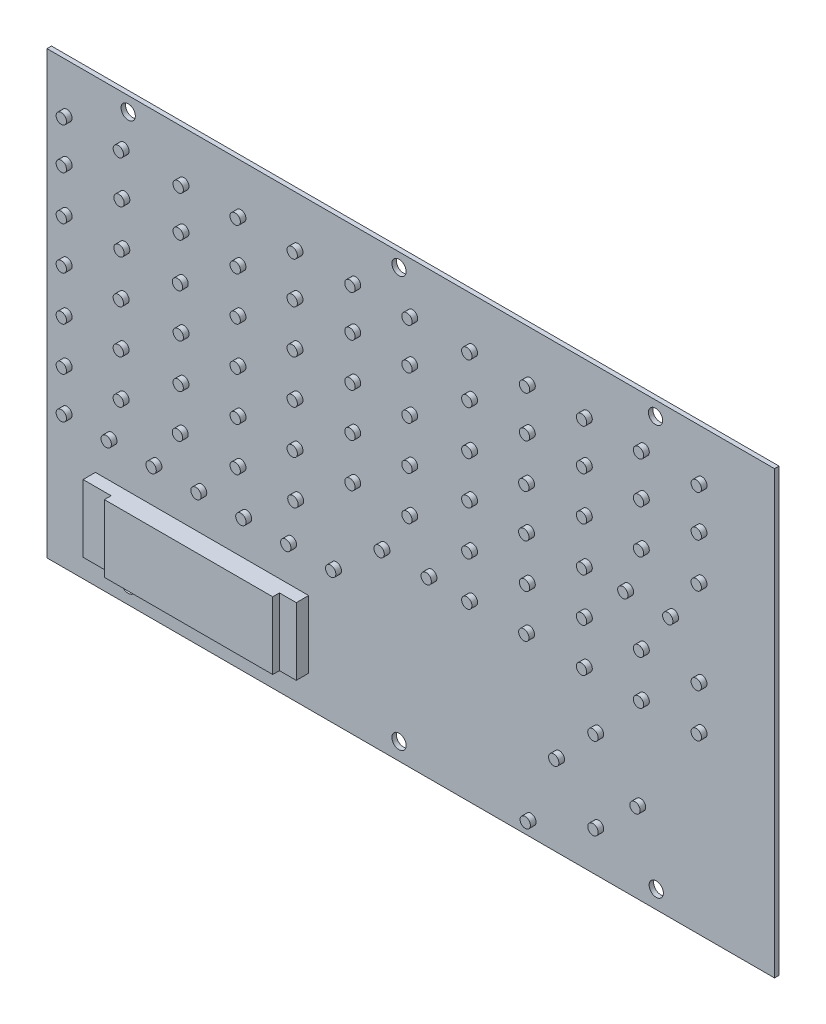
from build123d import *

# Parameters (mm, degrees)
SKETCH_2_W          = 129.667
SKETCH_2_H          = 78.613
EXTRUDE_1_DEPTH     = 0.8
SKETCH_3_R          = 1.27
CUT_EXTRUDE_1_DEPTH = 12.54
SKETCH_4_R          = 0.92202
SKETCH_4_R_2        = 0.922029104
SKETCH_4_R_3        = 0.919681264
SKETCH_4_R_4        = 0.924963229
SKETCH_4_R_5        = 0.92552898
EXTRUDE_2_DEPTH     = 1
SKETCH_5_W          = 38
SKETCH_5_H          = 12
EXTRUDE_3_DEPTH     = 2.2
SKETCH_6_W          = 30
SKETCH_6_H          = 12
EXTRUDE_4_DEPTH     = 1.2


with BuildPart() as part:
    # 草图2 → 凸台-拉伸1 (new body)
    with BuildSketch(Plane.XY):
        with Locations((83.3755, 41.2115)):
            Rectangle(SKETCH_2_W, SKETCH_2_H)
    extrude(amount=EXTRUDE_1_DEPTH)

    # 草图3 → 切除-拉伸1 (cut)
    with BuildSketch(Plane.XY.offset(0.8)):
        with Locations((33.02, 77.978)):
            Circle(SKETCH_3_R)
        with Locations((81.28, 78.105)):
            Circle(SKETCH_3_R)
        with Locations((127, 77.978)):
            Circle(SKETCH_3_R)
        with Locations((33.02, 4.953)):
            Circle(SKETCH_3_R)
        with Locations((81.28, 4.953)):
            Circle(SKETCH_3_R)
        with Locations((127.127, 5.08)):
            Circle(SKETCH_3_R)
    extrude(amount=-CUT_EXTRUDE_1_DEPTH, mode=Mode.SUBTRACT)

    # 草图4 → 凸台-拉伸2 (add)
    with BuildSketch(Plane.XY.offset(0.8)):
        with Locations((22.098, 72.009)):
            Circle(SKETCH_4_R)
        with Locations((22.098, 64.643)):
            Circle(SKETCH_4_R)
        with Locations((22.098, 56.769)):
            Circle(SKETCH_4_R)
        with Locations((22.098, 49.149)):
            Circle(SKETCH_4_R)
        with Locations((22.098, 26.162)):
            Circle(SKETCH_4_R)
        with Locations((22.098, 33.528)):
            Circle(SKETCH_4_R)
        with Locations((22.098, 41.275)):
            Circle(SKETCH_4_R)
        with Locations((32.258, 72.009)):
            Circle(SKETCH_4_R)
        with Locations((42.926, 71.882)):
            Circle(SKETCH_4_R)
        with Locations((53.086, 72.009)):
            Circle(SKETCH_4_R)
        with Locations((63.246, 71.882)):
            Circle(SKETCH_4_R)
        with Locations((73.533, 71.882)):
            Circle(SKETCH_4_R)
        with Locations((83.693, 71.882)):
            Circle(SKETCH_4_R)
        with Locations((94.361, 71.882)):
            Circle(SKETCH_4_R)
        with Locations((104.648, 71.882)):
            Circle(SKETCH_4_R)
        with Locations((114.808, 71.882)):
            Circle(SKETCH_4_R)
        with Locations((124.968, 71.882)):
            Circle(SKETCH_4_R)
        with Locations((135.255, 71.882)):
            Circle(SKETCH_4_R)
        with Locations((32.385, 64.516)):
            Circle(SKETCH_4_R)
        with Locations((32.385, 56.769)):
            Circle(SKETCH_4_R)
        with Locations((32.258, 49.022)):
            Circle(SKETCH_4_R)
        with Locations((32.258, 33.528)):
            Circle(SKETCH_4_R)
        with Locations((32.258, 41.275)):
            Circle(SKETCH_4_R)
        with Locations((54.102, 26.162)):
            Circle(SKETCH_4_R)
        with Locations((30.099, 26.162)):
            Circle(SKETCH_4_R)
        with Locations((38.1, 26.162)):
            Circle(SKETCH_4_R)
        with Locations((46.101, 26.162)):
            Circle(SKETCH_4_R)
        with Locations((42.926, 64.643)):
            Circle(SKETCH_4_R)
        with Locations((42.799, 56.769)):
            Circle(SKETCH_4_R)
        with Locations((53.086, 64.516)):
            Circle(SKETCH_4_R)
        with Locations((63.246, 64.516)):
            Circle(SKETCH_4_R)
        with Locations((53.086, 56.769)):
            Circle(SKETCH_4_R)
        with Locations((63.246, 56.769)):
            Circle(SKETCH_4_R)
        with Locations((42.937232377, 49.080669284)):
            Circle(SKETCH_4_R)
        with Locations((53.086, 49.022)):
            Circle(SKETCH_4_R)
        with Locations((63.246, 49.022)):
            Circle(SKETCH_4_R)
        with Locations((42.927878215, 41.278345649)):
            Circle(SKETCH_4_R)
        with Locations((42.78999374, 33.521368778)):
            Circle(SKETCH_4_R)
        with Locations((53.086, 33.528)):
            Circle(SKETCH_4_R)
        with Locations((53.096022403, 41.290450758)):
            Circle(SKETCH_4_R)
        with Locations((104.775, 4.699)):
            Circle(SKETCH_4_R)
        with Locations((116.84, 9.652)):
            Circle(SKETCH_4_R_2)
        with Locations((109.855, 16.891)):
            Circle(SKETCH_4_R)
        with Locations((124.333, 16.764)):
            Circle(SKETCH_4_R_3)
        with Locations((116.84, 24.257)):
            Circle(SKETCH_4_R_4)
        with Locations((135.255, 33.528)):
            Circle(SKETCH_4_R_5)
        with Locations((135.255, 41.275)):
            Circle(SKETCH_4_R)
        with Locations((124.968, 33.401)):
            Circle(SKETCH_4_R)
        with Locations((124.968, 41.275)):
            Circle(SKETCH_4_R)
        with Locations((114.808, 33.401)):
            Circle(SKETCH_4_R)
        with Locations((114.808, 41.148)):
            Circle(SKETCH_4_R)
        with Locations((130.175, 48.895)):
            Circle(SKETCH_4_R)
        with Locations((122.174, 48.895)):
            Circle(SKETCH_4_R)
        with Locations((114.808, 48.895)):
            Circle(SKETCH_4_R)
        with Locations((124.968, 56.769)):
            Circle(SKETCH_4_R)
        with Locations((114.808, 56.769)):
            Circle(SKETCH_4_R)
        with Locations((114.808, 64.516)):
            Circle(SKETCH_4_R)
        with Locations((124.968, 64.516)):
            Circle(SKETCH_4_R)
        with Locations((135.255, 64.516)):
            Circle(SKETCH_4_R)
        with Locations((62.103, 26.162)):
            Circle(SKETCH_4_R)
        with Locations((70.104, 26.162)):
            Circle(SKETCH_4_R)
        with Locations((63.373, 33.528)):
            Circle(SKETCH_4_R)
        with Locations((78.74, 33.528)):
            Circle(SKETCH_4_R)
        with Locations((87.122, 33.528)):
            Circle(SKETCH_4_R)
        with Locations((104.521, 33.528)):
            Circle(SKETCH_4_R)
        with Locations((94.361, 33.401)):
            Circle(SKETCH_4_R)
        with Locations((73.533, 41.275)):
            Circle(SKETCH_4_R)
        with Locations((63.246, 41.275)):
            Circle(SKETCH_4_R)
        with Locations((83.693, 41.275)):
            Circle(SKETCH_4_R)
        with Locations((104.648, 41.275)):
            Circle(SKETCH_4_R)
        with Locations((94.361, 41.148)):
            Circle(SKETCH_4_R)
        with Locations((73.533, 49.022)):
            Circle(SKETCH_4_R)
        with Locations((83.693, 49.022)):
            Circle(SKETCH_4_R)
        with Locations((94.361, 49.022)):
            Circle(SKETCH_4_R)
        with Locations((104.521, 49.022)):
            Circle(SKETCH_4_R)
        with Locations((73.533, 64.516)):
            Circle(SKETCH_4_R)
        with Locations((73.533, 56.769)):
            Circle(SKETCH_4_R)
        with Locations((83.693, 64.516)):
            Circle(SKETCH_4_R)
        with Locations((83.693, 56.769)):
            Circle(SKETCH_4_R)
        with Locations((94.361, 64.516)):
            Circle(SKETCH_4_R)
        with Locations((94.361, 56.642)):
            Circle(SKETCH_4_R)
        with Locations((104.521, 56.642)):
            Circle(SKETCH_4_R)
        with Locations((104.648, 64.516)):
            Circle(SKETCH_4_R)
        with Locations((135.255, 56.642)):
            Circle(SKETCH_4_R)
    extrude(amount=EXTRUDE_2_DEPTH)

    # 草图5 → 凸台-拉伸3 (add)
    with BuildSketch(Plane.XY.offset(0.8)):
        with Locations((46.17406, 13.42438)):
            Rectangle(SKETCH_5_W, SKETCH_5_H)
    extrude(amount=EXTRUDE_3_DEPTH)

    # 草图6 → 凸台-拉伸4 (add)
    with BuildSketch(Plane.XY.offset(3)):
        with Locations((47.17406, 13.42438)):
            Rectangle(SKETCH_6_W, SKETCH_6_H)
    extrude(amount=EXTRUDE_4_DEPTH)


solid = part.part
